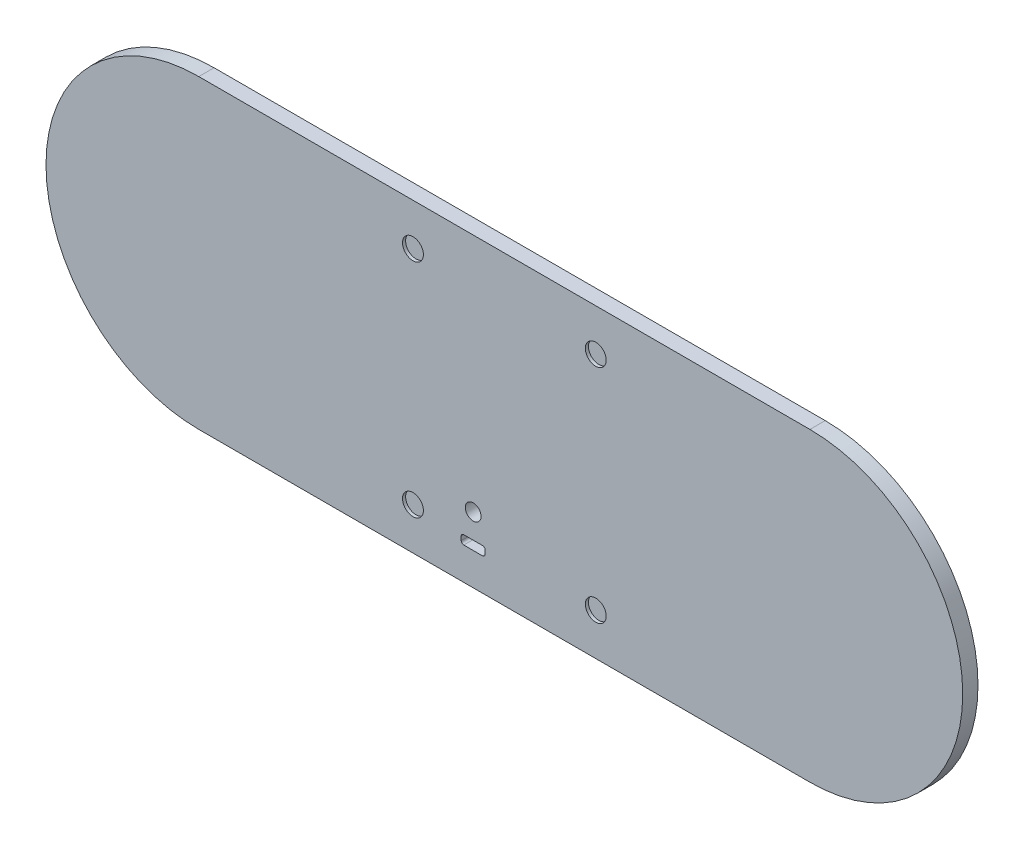
from build123d import *

# Parameters (mm, degrees)
BOSS_EXTRU_1_DEPTH      = 6
ESQUISSE2_R             = 4.1
ENL_V_MAT_EXTRU_1_DEPTH = 1.22
ENL_V_MAT_EXTRU_2_REACH = 191.832
ESQUISSE3_R             = 3.1
ENL_V_MAT_EXTRU_3_REACH = 191.832
ESQUISSE5_W             = 9.4
ESQUISSE5_H             = 3.5
CONG_1_R                = 1


with BuildPart() as part:
    # Esquisse1 → Boss.-Extru.1 (new body)
    with BuildSketch(Plane.XY):
        with BuildLine():
            Line((120, -60), (-120, -60))
            ThreePointArc((-120, -60), (-180, 0), (-120, 60))
            Line((-120, 60), (120, 60))
            ThreePointArc((120, 60), (180, 0), (120, -60))
        make_face()
    extrude(amount=BOSS_EXTRU_1_DEPTH)

    # Esquisse2 → Enlèv. mat.-Extru.1 (cut)
    with BuildSketch(Plane.XY.offset(6)):
        with Locations((-35.893989476, 43.512538926)):
            Circle(ESQUISSE2_R)
        with Locations((35.893989476, 43.512538926)):
            Circle(ESQUISSE2_R)
        with Locations((35.893989476, -43.512538926)):
            Circle(ESQUISSE2_R)
        with Locations((-35.893989476, -43.512538926)):
            Circle(ESQUISSE2_R)
    extrude(amount=-ENL_V_MAT_EXTRU_1_DEPTH, mode=Mode.SUBTRACT)

    # Esquisse3 → Enlèv. mat.-Extru.2 (cut, up to next)
    with BuildSketch(Plane(origin=(0, 0, 0), x_dir=(-1, 0, 0), z_dir=(0, 0, -1)), mode=Mode.PRIVATE) as enl_v_mat_extru_2_sk1:
        with Locations((12.25, -34.19)):
            Circle(ESQUISSE3_R)
    enl_v_mat_extru_2_tool1 = extrude(enl_v_mat_extru_2_sk1.sketch, amount=-ENL_V_MAT_EXTRU_2_REACH, mode=Mode.PRIVATE) & part.part
    add(enl_v_mat_extru_2_tool1.solids().sort_by_distance((-12.25, -34.19, 0))[0], mode=Mode.SUBTRACT)

    # Esquisse5 → Enlèv. mat.-Extru.3 (cut, up to next)
    with BuildSketch(Plane.XY.offset(6), mode=Mode.PRIVATE) as enl_v_mat_extru_3_sk1:
        with Locations((-12.25, -45.54)):
            Rectangle(ESQUISSE5_W, ESQUISSE5_H)
    enl_v_mat_extru_3_tool1 = extrude(enl_v_mat_extru_3_sk1.sketch, amount=-ENL_V_MAT_EXTRU_3_REACH, mode=Mode.PRIVATE) & part.part
    add(enl_v_mat_extru_3_tool1.solids().sort_by_distance((-12.25, -45.54, 6))[0], mode=Mode.SUBTRACT)

    # Congé1
    cong_1_edges = [part.edges().sort_by_distance(p)[0] for p in [
        (-7.55, -43.79, 3),
        (-7.55, -47.29, 3),
        (-16.95, -47.29, 3),
        (-16.95, -43.79, 3),
    ]]
    fillet(cong_1_edges, radius=CONG_1_R)


solid = part.part
